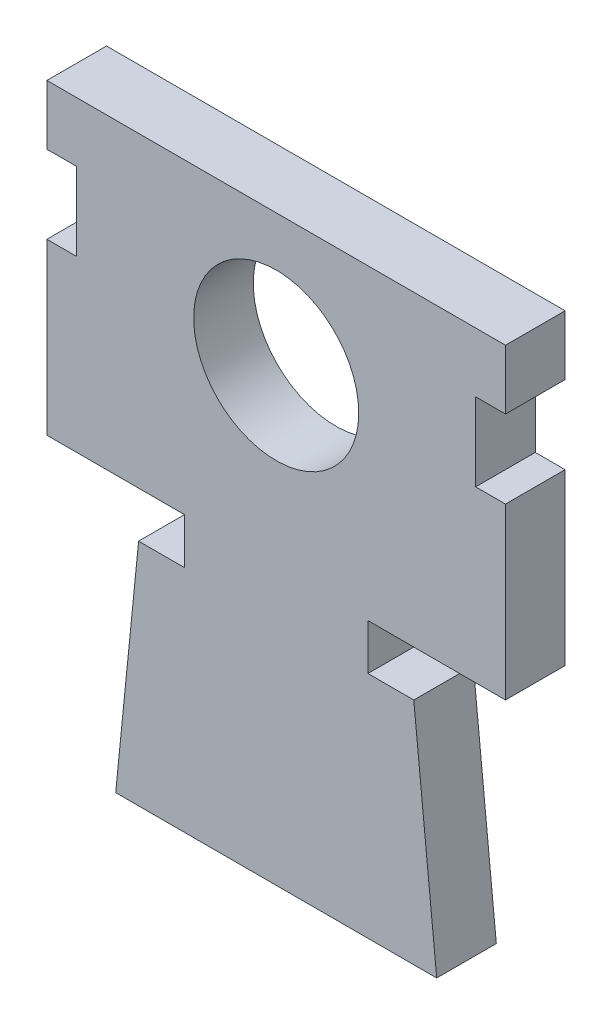
from build123d import *

# Parameters (mm, degrees)
SKETCH1_R           = 1.8
BOSS_EXTRUDE1_DEPTH = 1.3


with BuildPart() as part:
    # Sketch1 → Boss-Extrude1 (new body)
    with BuildSketch(Plane.XY):
        Polygon((-8.56550235, 65.917412861), (1.43449765, 65.917412861), (1.43449765, 64.617412861), (0.78449765, 64.617412861), (0.78449765, 62.917412861), (1.43449765, 62.917412861), (1.43449765, 59.217412861), (-1.56550235, 59.217412861), (-1.56550235, 58.217412861), (-0.56550235, 58.217412861), (-0.06550235, 53.217412861), (-7.06550235, 53.217412861), (-6.56550235, 58.217412861), (-5.56550235, 58.217412861), (-5.56550235, 59.217412861), (-8.56550235, 59.217412861), (-8.56550235, 62.917412861), (-7.91550235, 62.917412861), (-7.91550235, 64.617412861), (-8.56550235, 64.617412861), align=None)
        with Locations((-3.56550235, 63.037412861)):
            Circle(SKETCH1_R, mode=Mode.SUBTRACT)
    extrude(amount=BOSS_EXTRUDE1_DEPTH)


solid = part.part
